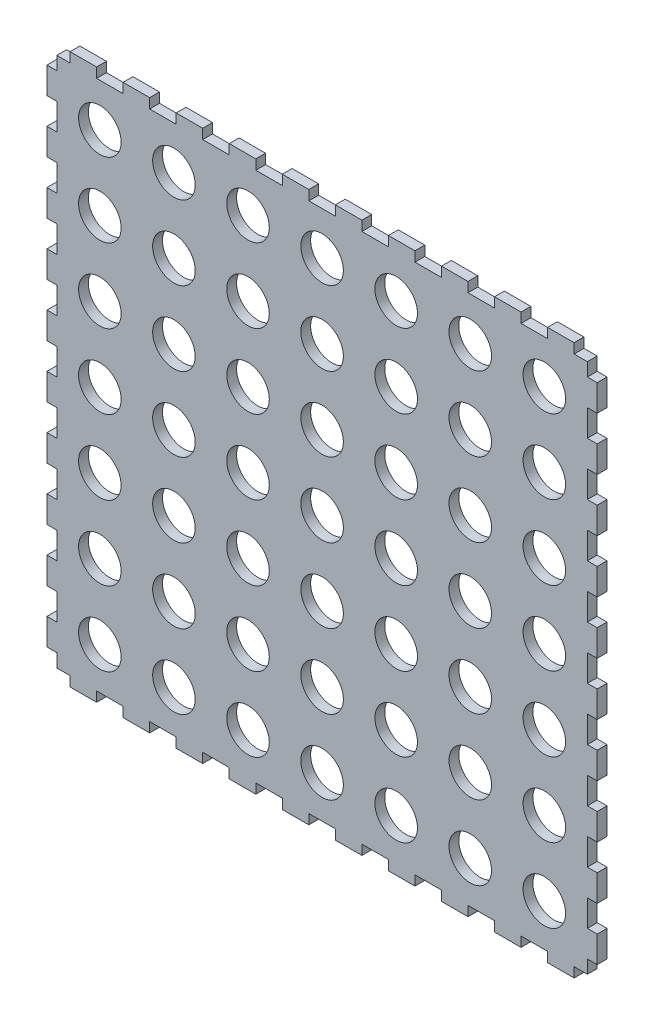
from build123d import *

# Parameters (mm, degrees)
MODEL_R             = 13.75
BOSS_EXTRUDE2_DEPTH = 6.35


with BuildPart() as part:
    # Model → Boss-Extrude2 (new body)
    with BuildSketch(Plane.XY):
        Polygon((-342.9, -0.75), (-334.3275, -0.75), (-334.3275, 5.6), (-317.1825, 5.6), (-317.1825, -0.75), (-300.0375, -0.75), (-300.0375, 5.6), (-282.8925, 5.6), (-282.8925, -0.75), (-265.7475, -0.75), (-265.7475, 5.6), (-248.6025, 5.6), (-248.6025, -0.75), (-231.4575, -0.75), (-231.4575, 5.6), (-214.3125, 5.6), (-214.3125, -0.75), (-197.1675, -0.75), (-197.1675, 5.6), (-180.0225, 5.6), (-180.0225, -0.75), (-162.8775, -0.75), (-162.8775, 5.6), (-145.7325, 5.6), (-145.7325, -0.75), (-128.5875, -0.75), (-128.5875, 5.6), (-111.4425, 5.6), (-111.4425, -0.75), (-94.2975, -0.75), (-94.2975, 5.6), (-77.1525, 5.6), (-77.1525, -0.75), (-60.0075, -0.75), (-60.0075, 5.6), (-42.8625, 5.6), (-42.8625, -0.75), (-25.7175, -0.75), (-25.7175, 5.6), (-8.5725, 5.6), (-8.5725, -0.75), (0, -0.75), (0, -9.3225), (6.35, -9.3225), (6.35, -26.4675), (0, -26.4675), (0, -43.6125), (6.35, -43.6125), (6.35, -60.7575), (0, -60.7575), (0, -77.9025), (6.35, -77.9025), (6.35, -95.0475), (0, -95.0475), (0, -112.1925), (6.35, -112.1925), (6.35, -129.3375), (0, -129.3375), (0, -146.4825), (6.35, -146.4825), (6.35, -163.6275), (0, -163.6275), (0, -180.7725), (6.35, -180.7725), (6.35, -197.9175), (0, -197.9175), (0, -215.0625), (6.35, -215.0625), (6.35, -232.2075), (0, -232.2075), (0, -249.3525), (6.35, -249.3525), (6.35, -266.4975), (0, -266.4975), (0, -283.6425), (6.35, -283.6425), (6.35, -300.7875), (0, -300.7875), (0, -317.9325), (6.35, -317.9325), (6.35, -335.0775), (0, -335.0775), (0, -343.65), (-8.5725, -343.65), (-8.5725, -350), (-25.7175, -350), (-25.7175, -343.65), (-42.8625, -343.65), (-42.8625, -350), (-60.0075, -350), (-60.0075, -343.65), (-77.1525, -343.65), (-77.1525, -350), (-94.2975, -350), (-94.2975, -343.65), (-111.4425, -343.65), (-111.4425, -350), (-128.5875, -350), (-128.5875, -343.65), (-145.7325, -343.65), (-145.7325, -350), (-162.8775, -350), (-162.8775, -343.65), (-180.0225, -343.65), (-180.0225, -350), (-197.1675, -350), (-197.1675, -343.65), (-214.3125, -343.65), (-214.3125, -350), (-231.4575, -350), (-231.4575, -343.65), (-248.6025, -343.65), (-248.6025, -350), (-265.7475, -350), (-265.7475, -343.65), (-282.8925, -343.65), (-282.8925, -350), (-300.0375, -350), (-300.0375, -343.65), (-317.1825, -343.65), (-317.1825, -350), (-334.3275, -350), (-334.3275, -343.65), (-342.9, -343.65), (-342.9, -335.0775), (-349.25, -335.0775), (-349.25, -317.9325), (-342.9, -317.9325), (-342.9, -300.7875), (-349.25, -300.7875), (-349.25, -283.6425), (-342.9, -283.6425), (-342.9, -266.4975), (-349.25, -266.4975), (-349.25, -249.3525), (-342.9, -249.3525), (-342.9, -232.2075), (-349.25, -232.2075), (-349.25, -215.0625), (-342.9, -215.0625), (-342.9, -197.9175), (-349.25, -197.9175), (-349.25, -180.7725), (-342.9, -180.7725), (-342.9, -163.6275), (-349.25, -163.6275), (-349.25, -146.4825), (-342.9, -146.4825), (-342.9, -129.3375), (-349.25, -129.3375), (-349.25, -112.1925), (-342.9, -112.1925), (-342.9, -95.0475), (-349.25, -95.0475), (-349.25, -77.9025), (-342.9, -77.9025), (-342.9, -60.7575), (-349.25, -60.7575), (-349.25, -43.6125), (-342.9, -43.6125), (-342.9, -26.4675), (-349.25, -26.4675), (-349.25, -9.3225), (-342.9, -9.3225), align=None)
        with Locations((-267.208, -28.563)):
            Circle(MODEL_R, mode=Mode.SUBTRACT)
        with Locations((-219.329, -28.563)):
            Circle(MODEL_R, mode=Mode.SUBTRACT)
        with Locations((-171.45, -28.563)):
            Circle(MODEL_R, mode=Mode.SUBTRACT)
        with Locations((-123.571, -28.563)):
            Circle(MODEL_R, mode=Mode.SUBTRACT)
        with Locations((-75.692, -28.563)):
            Circle(MODEL_R, mode=Mode.SUBTRACT)
        with Locations((-27.813, -28.563)):
            Circle(MODEL_R, mode=Mode.SUBTRACT)
        with Locations((-267.208, -76.569)):
            Circle(MODEL_R, mode=Mode.SUBTRACT)
        with Locations((-219.329, -76.569)):
            Circle(MODEL_R, mode=Mode.SUBTRACT)
        with Locations((-171.45, -76.569)):
            Circle(MODEL_R, mode=Mode.SUBTRACT)
        with Locations((-123.571, -76.569)):
            Circle(MODEL_R, mode=Mode.SUBTRACT)
        with Locations((-75.692, -76.569)):
            Circle(MODEL_R, mode=Mode.SUBTRACT)
        with Locations((-27.813, -76.569)):
            Circle(MODEL_R, mode=Mode.SUBTRACT)
        with Locations((-267.208, -124.575)):
            Circle(MODEL_R, mode=Mode.SUBTRACT)
        with Locations((-219.329, -124.575)):
            Circle(MODEL_R, mode=Mode.SUBTRACT)
        with Locations((-171.45, -124.575)):
            Circle(MODEL_R, mode=Mode.SUBTRACT)
        with Locations((-123.571, -124.575)):
            Circle(MODEL_R, mode=Mode.SUBTRACT)
        with Locations((-75.692, -124.575)):
            Circle(MODEL_R, mode=Mode.SUBTRACT)
        with Locations((-27.813, -124.575)):
            Circle(MODEL_R, mode=Mode.SUBTRACT)
        with Locations((-267.208, -172.581)):
            Circle(MODEL_R, mode=Mode.SUBTRACT)
        with Locations((-219.329, -172.581)):
            Circle(MODEL_R, mode=Mode.SUBTRACT)
        with Locations((-171.45, -172.581)):
            Circle(MODEL_R, mode=Mode.SUBTRACT)
        with Locations((-123.571, -172.581)):
            Circle(MODEL_R, mode=Mode.SUBTRACT)
        with Locations((-75.692, -172.581)):
            Circle(MODEL_R, mode=Mode.SUBTRACT)
        with Locations((-27.813, -172.581)):
            Circle(MODEL_R, mode=Mode.SUBTRACT)
        with Locations((-267.208, -220.587)):
            Circle(MODEL_R, mode=Mode.SUBTRACT)
        with Locations((-219.329, -220.587)):
            Circle(MODEL_R, mode=Mode.SUBTRACT)
        with Locations((-171.45, -220.587)):
            Circle(MODEL_R, mode=Mode.SUBTRACT)
        with Locations((-123.571, -220.587)):
            Circle(MODEL_R, mode=Mode.SUBTRACT)
        with Locations((-75.692, -220.587)):
            Circle(MODEL_R, mode=Mode.SUBTRACT)
        with Locations((-27.813, -220.587)):
            Circle(MODEL_R, mode=Mode.SUBTRACT)
        with Locations((-267.208, -268.593)):
            Circle(MODEL_R, mode=Mode.SUBTRACT)
        with Locations((-219.329, -268.593)):
            Circle(MODEL_R, mode=Mode.SUBTRACT)
        with Locations((-171.45, -268.593)):
            Circle(MODEL_R, mode=Mode.SUBTRACT)
        with Locations((-123.571, -268.593)):
            Circle(MODEL_R, mode=Mode.SUBTRACT)
        with Locations((-75.692, -268.593)):
            Circle(MODEL_R, mode=Mode.SUBTRACT)
        with Locations((-27.813, -268.593)):
            Circle(MODEL_R, mode=Mode.SUBTRACT)
        with Locations((-267.208, -316.599)):
            Circle(MODEL_R, mode=Mode.SUBTRACT)
        with Locations((-219.329, -316.599)):
            Circle(MODEL_R, mode=Mode.SUBTRACT)
        with Locations((-171.45, -316.599)):
            Circle(MODEL_R, mode=Mode.SUBTRACT)
        with Locations((-123.571, -316.599)):
            Circle(MODEL_R, mode=Mode.SUBTRACT)
        with Locations((-75.692, -316.599)):
            Circle(MODEL_R, mode=Mode.SUBTRACT)
        with Locations((-27.813, -316.599)):
            Circle(MODEL_R, mode=Mode.SUBTRACT)
        with Locations((-315.087, -76.569)):
            Circle(MODEL_R, mode=Mode.SUBTRACT)
        with Locations((-315.087, -124.575)):
            Circle(MODEL_R, mode=Mode.SUBTRACT)
        with Locations((-315.087, -172.581)):
            Circle(MODEL_R, mode=Mode.SUBTRACT)
        with Locations((-315.087, -220.587)):
            Circle(MODEL_R, mode=Mode.SUBTRACT)
        with Locations((-315.087, -268.593)):
            Circle(MODEL_R, mode=Mode.SUBTRACT)
        with Locations((-315.087, -316.599)):
            Circle(MODEL_R, mode=Mode.SUBTRACT)
        with Locations((-315.087, -28.563)):
            Circle(MODEL_R, mode=Mode.SUBTRACT)
    extrude(amount=BOSS_EXTRUDE2_DEPTH)


solid = part.part
